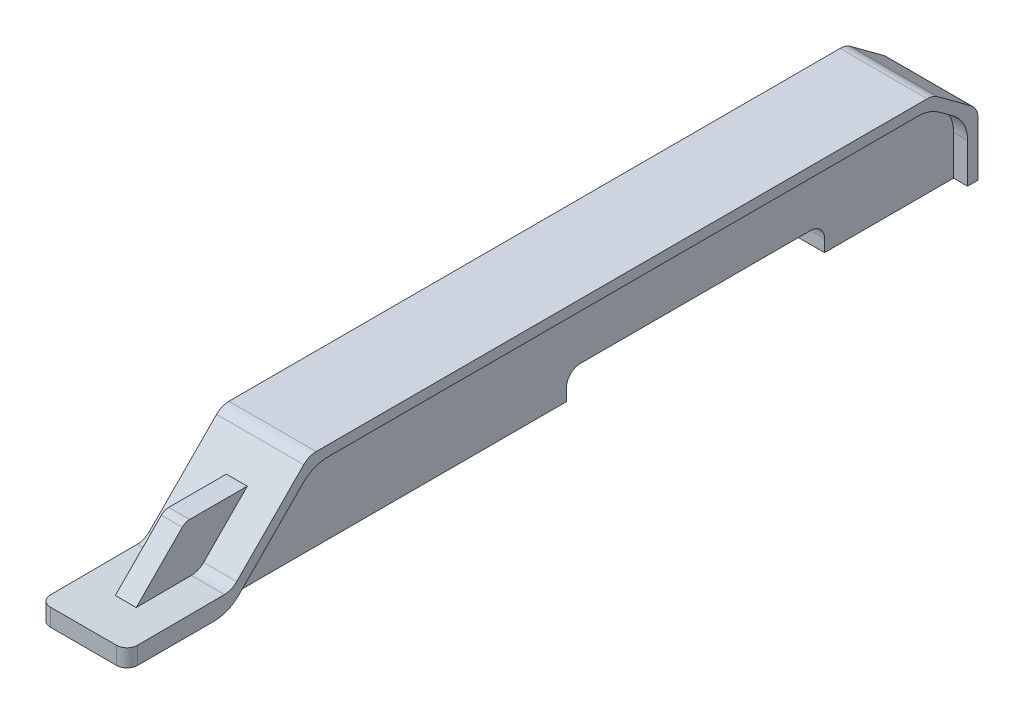
from build123d import *

# Parameters (mm, degrees)
BOSS_EXTRUDE1_DEPTH      = 25
CUT_EXTRUDE1_DEPTH       = 4
FILLET1_R                = 4
FILLET2_R                = 10
FILLET3_R                = 5
FILLET4_R                = 3
BOSS_EXTRUDE2_DEPTH      = 3
BOSS_EXTRUDE2_DEPTH_BACK = 3
FILLET5_R                = 3


with BuildPart() as part:
    # Sketch1 → Boss-Extrude1 (new body)
    with BuildSketch(Plane(origin=(0, 0, 0), x_dir=(0, 0, -1), z_dir=(1, 0, 0))):
        Polygon((0, 0), (-130, 0), (-130, 5), (-100.000366453, 5.148280317), (-77.868517379, 27.5), (101.088229162, 27.5), (114, 18), (114, 0), (74, 0), (74, 7.5), (0, 7.5), align=None)
    extrude(amount=BOSS_EXTRUDE1_DEPTH)

    # Sketch4 → Cut-Extrude1 (cut)
    with BuildSketch(Plane(origin=(25, 0, 0), x_dir=(0, 0, -1), z_dir=(1, 0, 0))):
        Polygon((-100.876178749, 0), (0, 0), (111, 0), (111, 3), (111, 16.482758557), (100.103496394, 24.5), (-76.617181678, 24.5), align=None)
    cut_extrude1 = extrude(amount=-CUT_EXTRUDE1_DEPTH, mode=Mode.SUBTRACT)

    # Mirror2: Cut-Extrude1 across plane
    add(cut_extrude1.mirror(Plane(origin=(12.5, 0, 0), x_dir=(0, 0, 1), z_dir=(1, 0, 0))), mode=Mode.SUBTRACT)

    # Fillet1
    fillet1_edges = [part.edges().sort_by_distance(p)[0] for p in [
        (12.5, 7.5, -74),
        (12.5, 7.5, 0),
    ]]
    fillet(fillet1_edges, radius=FILLET1_R)

    # Fillet2
    fillet2_edges = [part.edges().sort_by_distance(p)[0] for p in [
        (23, 0, 100.876178749),
        (23, 24.5, 76.617181678),
        (23, 24.5, -100.103496394),
        (23, 16.482758557, -111),
        (2, 0, 100.876178749),
        (2, 16.482758557, -111),
        (2, 24.5, -100.103496394),
        (2, 24.5, 76.617181678),
    ]]
    fillet(fillet2_edges, radius=FILLET2_R)

    # Fillet3
    fillet3_edges = [part.edges().sort_by_distance(p)[0] for p in [
        (12.5, 5.148280317, 100.000366453),
        (12.5, 27.5, 77.868517379),
        (12.5, 27.5, -101.088229162),
        (12.5, 18, -114),
    ]]
    fillet(fillet3_edges, radius=FILLET3_R)

    # Fillet4
    fillet4_edges = [part.edges().sort_by_distance(p)[0] for p in [
        (0, 2.5, 130),
        (25, 2.5, 130),
    ]]
    fillet(fillet4_edges, radius=FILLET4_R)

    # Sketch5 → Boss-Extrude2 (add, two sides: drawn at the far end of the back side and taken through both)
    with BuildSketch(Plane(origin=(12.5, 0, 0), x_dir=(0, 0, -1), z_dir=(1, 0, 0)).offset(-BOSS_EXTRUDE2_DEPTH_BACK)):
        Polygon((-117.8659777, 5.059975288), (-103.793914836, 19.271838176), (-72.605250228, 19.271838176), (-95.8659777, 5.059975288), align=None)
    extrude(amount=BOSS_EXTRUDE2_DEPTH + BOSS_EXTRUDE2_DEPTH_BACK)

    # Fillet5
    fillet5_edges = [part.edges().sort_by_distance(p)[0] for p in [
        (12.5, 19.271838176, 103.793914836),
    ]]
    fillet(fillet5_edges, radius=FILLET5_R)


solid = part.part
